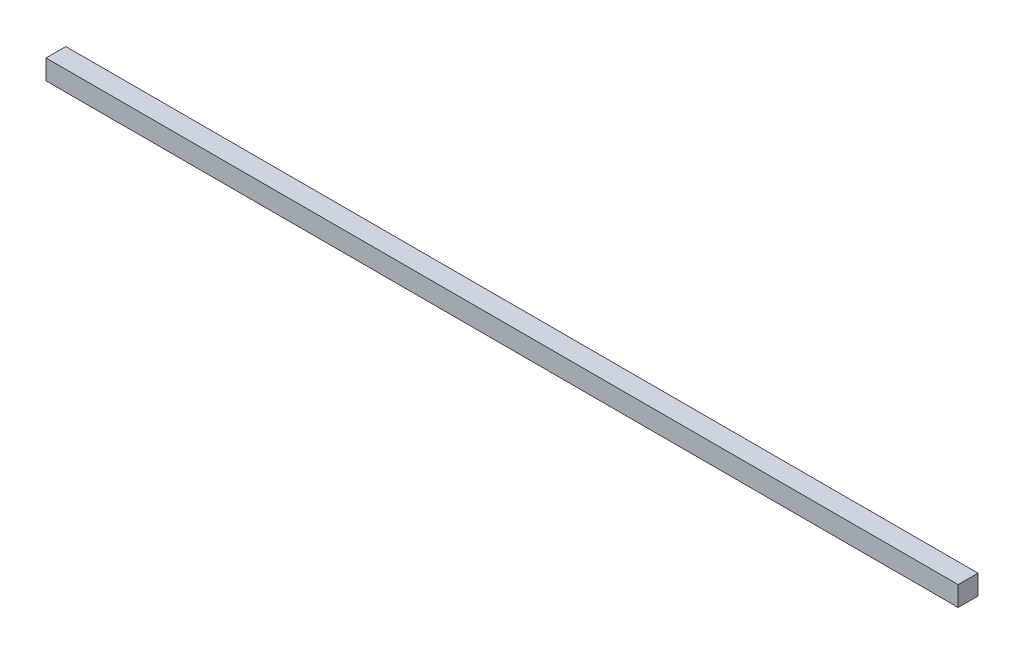
from build123d import *

# Parameters (mm, degrees)
SKETCH1_W           = 25.4
SKETCH1_H           = 25.4
BOSS_EXTRUDE1_DEPTH = 1168.4


with BuildPart() as part:
    # Sketch1 → Boss-Extrude1 (new body)
    with BuildSketch(Plane(origin=(0, 0, 0), x_dir=(0, 0, -1), z_dir=(1, 0, 0))):
        Rectangle(SKETCH1_W, SKETCH1_H)
    extrude(amount=BOSS_EXTRUDE1_DEPTH)


solid = part.part
